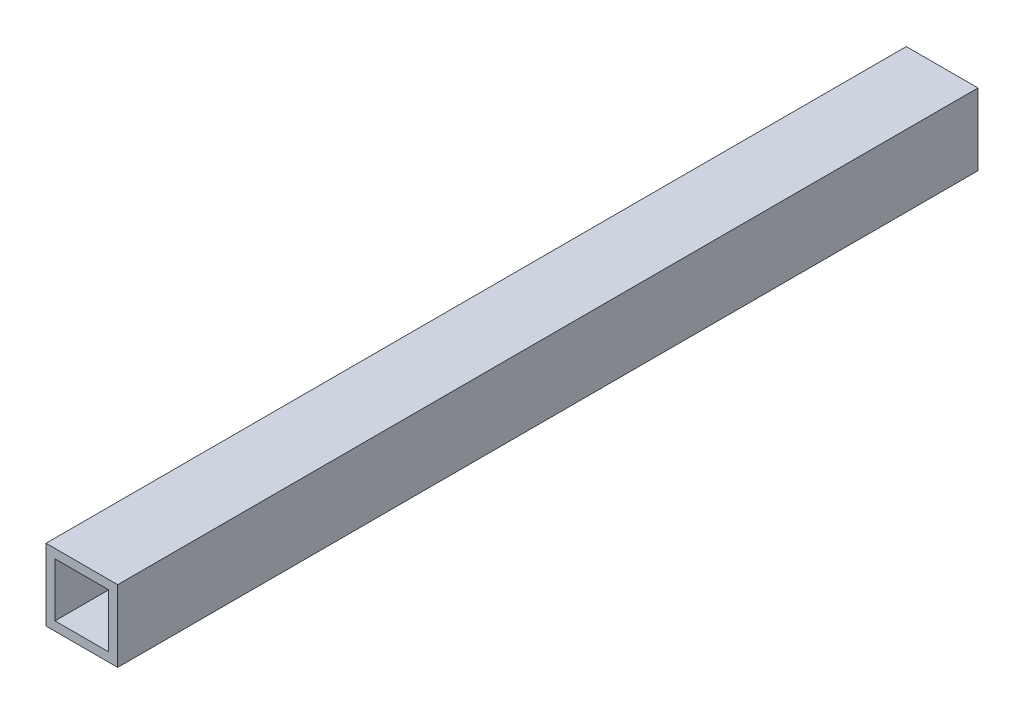
from build123d import *

# Parameters (mm, degrees)
SKETCH2_W           = 50.8
SKETCH2_H           = 50.8
SKETCH2_W_2         = 38.1
SKETCH2_H_2         = 38.1
BOSS_EXTRUDE2_DEPTH = 609.6


with BuildPart() as part:
    # Sketch2 → Boss-Extrude2 (new body)
    with BuildSketch(Plane.XY):
        Rectangle(SKETCH2_W, SKETCH2_H)
        Rectangle(SKETCH2_W_2, SKETCH2_H_2, mode=Mode.SUBTRACT)
    extrude(amount=BOSS_EXTRUDE2_DEPTH)


solid = part.part
